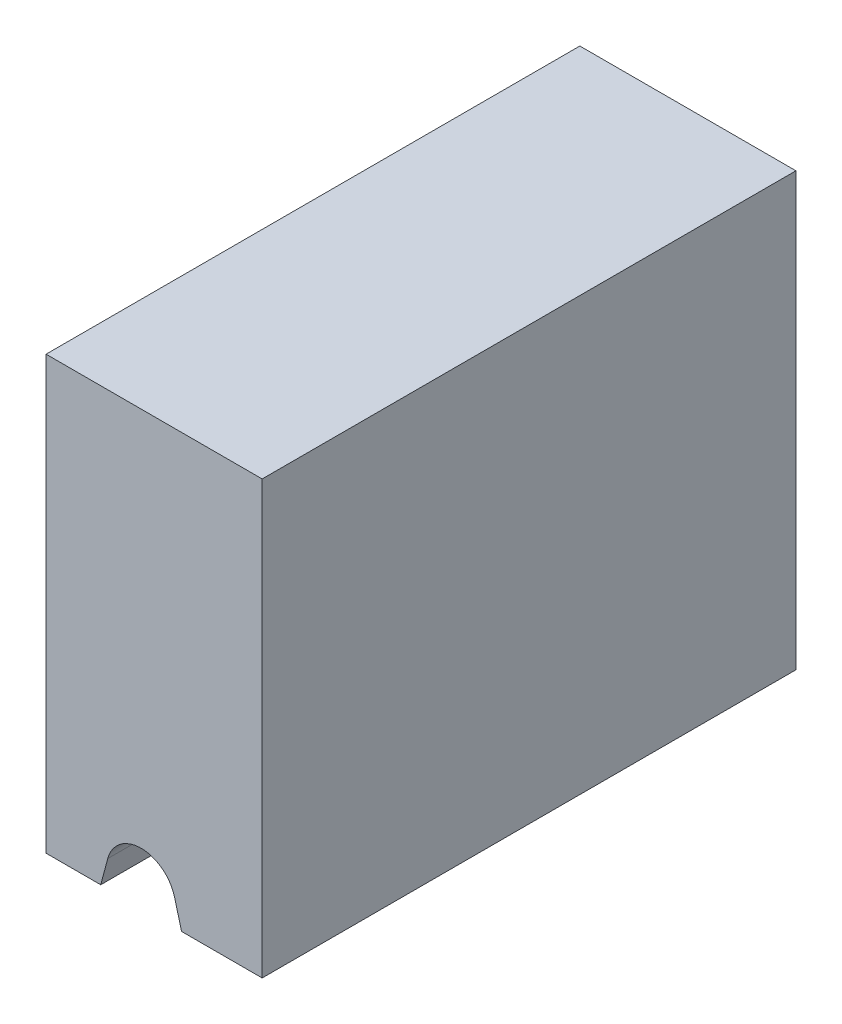
from build123d import *

# Parameters (mm, degrees)
SKETCH1_W           = 25
SKETCH1_H           = 50
BOSS_EXTRUDE1_DEPTH = 30.875
CUT_EXTRUDE1_REACH  = 82.432


with BuildPart() as part:
    # Sketch1 → Boss-Extrude1 (new, symmetric)
    with BuildSketch(Plane.XY):
        with Locations((0, -25)):
            Rectangle(SKETCH1_W, SKETCH1_H)
    extrude(amount=BOSS_EXTRUDE1_DEPTH, both=True)

    # Sketch2 → Cut-Extrude1 (cut, up to next)
    with BuildSketch(Plane(origin=(0, 0, -30.875), x_dir=(-1, 0, 0), z_dir=(0, 0, -1)), mode=Mode.PRIVATE) as cut_extrude1_sk1:
        with BuildLine():
            Line((-2.363703305, -46.96472382), (-3.177003107, -50))
            Line((-3.177003107, -50), (6.177003107, -50))
            Line((6.177003107, -50), (5.363703305, -46.96472382))
            ThreePointArc((5.363703305, -46.96472382), (1.5, -44), (-2.363703305, -46.96472382))
        make_face()
    cut_extrude1_tool1 = extrude(cut_extrude1_sk1.sketch, amount=-CUT_EXTRUDE1_REACH, mode=Mode.PRIVATE) & part.part
    add(cut_extrude1_tool1.solids().sort_by_distance((-1.5, -47.423831, -30.875))[0], mode=Mode.SUBTRACT)


solid = part.part
